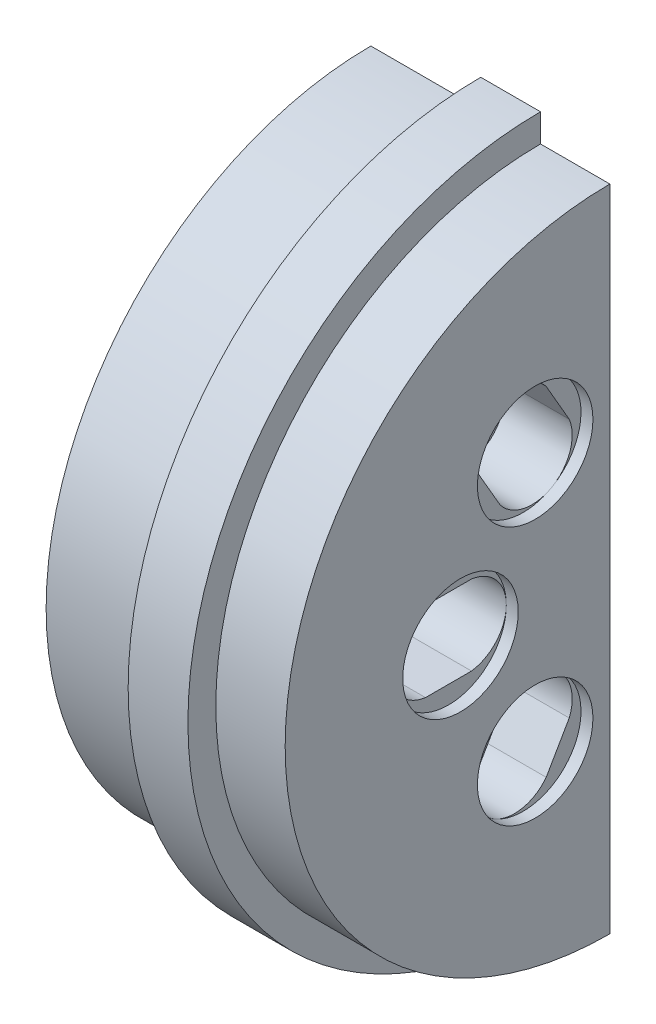
from build123d import *

# Parameters (mm, degrees)
REVOLVE_1_ANGLE     = 180
SKETCH_2_R          = 6.6
CUT_EXTRUDE_1_DEPTH = 139.796613792
CUT_EXTRUDE_2_DEPTH = 20
SKETCH_6_R          = 14.5
CUT_EXTRUDE_3_DEPTH = 3


with BuildPart() as part:
    # Эскиз1 → Повернуть1 (revolve)
    with BuildSketch(Plane.XY):
        Polygon((12.5885, -88.5), (-2.4115, -88.5), (-2.4115, -81.5), (-30, -81.5), (-30, 0), (30, 0), (30, -81.5), (12.5885, -81.5), align=None)
    revolve(axis=Axis((0, 0, 0), (-1, 0, 0)), revolution_arc=REVOLVE_1_ANGLE)

    # Эскиз2 → Вырез-Вытянуть1 (cut, through all)
    with BuildSketch(Plane(origin=(30, 0, 0), x_dir=(0, 0, -1), z_dir=(1, 0, 0))):
        with Locations((-37.5, 0)):
            Circle(SKETCH_2_R)
        with Locations((-18.75, 32.475952642)):
            Circle(SKETCH_2_R)
        with Locations((18.75, 32.475952642)):
            Circle(SKETCH_2_R)
        with Locations((37.5, 0)):
            Circle(SKETCH_2_R)
        with Locations((18.75, -32.475952642)):
            Circle(SKETCH_2_R)
        with Locations((-18.75, -32.475952642)):
            Circle(SKETCH_2_R)
    extrude(amount=-CUT_EXTRUDE_1_DEPTH, mode=Mode.SUBTRACT)

    # Эскиз5 → Вырез-Вытянуть2 (cut)
    with BuildSketch(Plane(origin=(30, 0, 0), x_dir=(0, 0, -1), z_dir=(1, 0, 0))):
        with BuildLine():
            Line((-7.202994616, 32.475952642), (-12.976497308, 42.475952642))
            ThreePointArc((-12.976497308, 42.475952642), (-26, 45.033320997), (-30.297005384, 32.475952642))
            Line((-30.297005384, 32.475952642), (-24.523502692, 22.475952642))
            ThreePointArc((-24.523502692, 22.475952642), (-11.5, 19.918584287), (-7.202994616, 32.475952642))
        make_face()
        with BuildLine():
            Line((24.523502692, 22.475952642), (30.297005384, 32.475952642))
            ThreePointArc((30.297005384, 32.475952642), (26, 45.033320997), (12.976497308, 42.475952642))
            Line((12.976497308, 42.475952642), (7.202994616, 32.475952642))
            ThreePointArc((7.202994616, 32.475952642), (11.5, 19.918584287), (24.523502692, 22.475952642))
        make_face()
        with BuildLine():
            Line((31.726497308, -10), (43.273502692, -10))
            ThreePointArc((43.273502692, -10), (52, 0), (43.273502692, 10))
            Line((43.273502692, 10), (31.726497308, 10))
            ThreePointArc((31.726497308, 10), (23, 0), (31.726497308, -10))
        make_face()
        with BuildLine():
            Line((7.202994616, -32.475952642), (12.976497308, -42.475952642))
            ThreePointArc((12.976497308, -42.475952642), (26, -45.033320997), (30.297005384, -32.475952642))
            Line((30.297005384, -32.475952642), (24.523502692, -22.475952642))
            ThreePointArc((24.523502692, -22.475952642), (11.5, -19.918584287), (7.202994616, -32.475952642))
        make_face()
        with BuildLine():
            Line((-24.523502692, -22.475952642), (-30.297005384, -32.475952642))
            ThreePointArc((-30.297005384, -32.475952642), (-26, -45.033320997), (-12.976497308, -42.475952642))
            Line((-12.976497308, -42.475952642), (-7.202994616, -32.475952642))
            ThreePointArc((-7.202994616, -32.475952642), (-11.5, -19.918584287), (-24.523502692, -22.475952642))
        make_face()
        with BuildLine():
            Line((-31.726497308, 10), (-43.273502692, 10))
            ThreePointArc((-43.273502692, 10), (-52, 0), (-43.273502692, -10))
            Line((-43.273502692, -10), (-31.726497308, -10))
            ThreePointArc((-31.726497308, -10), (-23, 0), (-31.726497308, 10))
        make_face()
    extrude(amount=-CUT_EXTRUDE_2_DEPTH, mode=Mode.SUBTRACT)

    # Эскиз6 → Вырез-Вытянуть3 (cut)
    with BuildSketch(Plane(origin=(30, 0, 0), x_dir=(0, 0, -1), z_dir=(1, 0, 0))):
        with Locations((-37.5, 0)):
            Circle(SKETCH_6_R)
        with Locations((-18.75, -32.475952642)):
            Circle(SKETCH_6_R)
        with Locations((-18.75, 32.475952642)):
            Circle(SKETCH_6_R)
    extrude(amount=-CUT_EXTRUDE_3_DEPTH, mode=Mode.SUBTRACT)


solid = part.part
